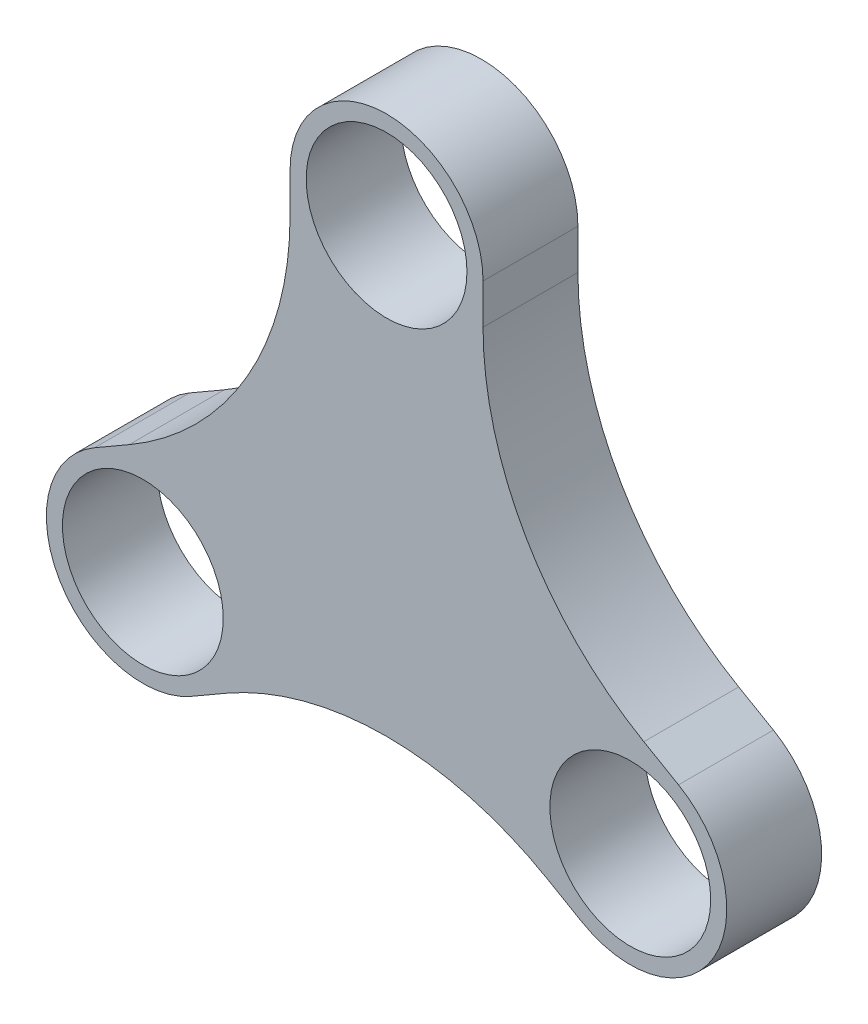
from build123d import *

# Parameters (mm, degrees)
EXTRUDE_1_DEPTH     = 59
SKETCH_2_R          = 50
CUT_EXTRUDE_1_DEPTH = 322.653980979


with BuildPart() as part:
    # 草图1 → 凸台-拉伸1 (new body)
    with BuildSketch(Plane.XY):
        with BuildLine():
            Line((-60, 150.111069989), (-60, 175))
            ThreePointArc((-60, 175), (0, 235), (60, 175))
            Line((60, 175), (60, 150.111069989))
            ThreePointArc((60, 150.111069989), (86.794919243, 50.111069989), (160, -23.094010768))
            Line((160, -23.094010768), (181.554445662, -35.538475773))
            ThreePointArc((181.554445662, -35.538475773), (203.515969889, -117.5), (121.554445662, -139.461524227))
            Line((121.554445662, -139.461524227), (100, -127.017059222))
            ThreePointArc((100, -127.017059222), (0, -100.222139979), (-100, -127.017059222))
            Line((-100, -127.017059222), (-121.554445662, -139.461524227))
            ThreePointArc((-121.554445662, -139.461524227), (-203.515969889, -117.5), (-181.554445662, -35.538475773))
            Line((-181.554445662, -35.538475773), (-160, -23.094010768))
            ThreePointArc((-160, -23.094010768), (-86.794919243, 50.111069989), (-60, 150.111069989))
        make_face()
    extrude(amount=EXTRUDE_1_DEPTH)

    # 草图2 → 切除-拉伸1 (cut, through all)
    with BuildSketch(Plane.XY.offset(59)):
        with Locations((-151.554445662, -87.5)):
            Circle(SKETCH_2_R)
        with Locations((0, 175)):
            Circle(SKETCH_2_R)
        with Locations((151.554445662, -87.5)):
            Circle(SKETCH_2_R)
    extrude(amount=-CUT_EXTRUDE_1_DEPTH, mode=Mode.SUBTRACT)


solid = part.part
